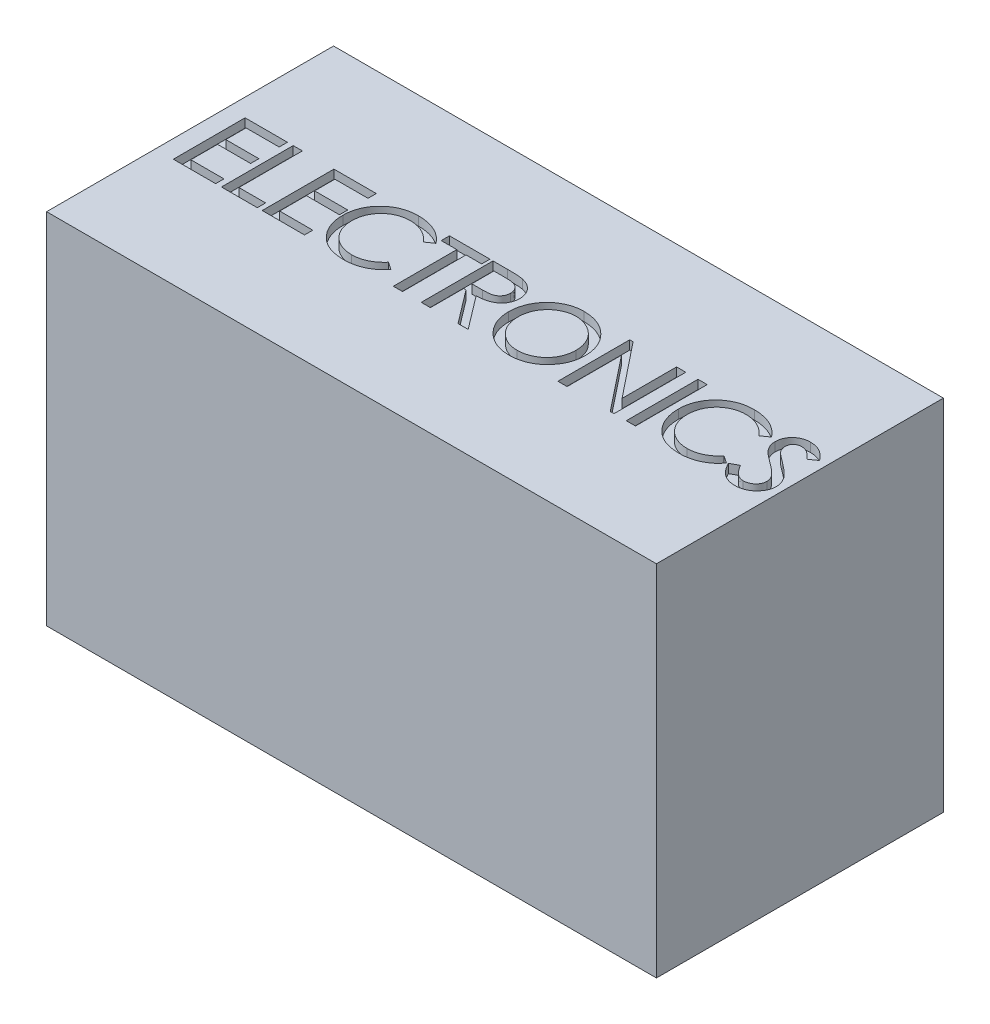
from build123d import *

# Parameters (mm, degrees)
SKETCH1_W           = 215.9
SKETCH1_H           = 127
BOSS_EXTRUDE1_DEPTH = 101.6
SKETCH2_W           = 3.256410256
SKETCH2_H           = 25.4
CUT_EXTRUDE1_DEPTH  = 3.175


with BuildPart() as part:
    # Sketch1 → Boss-Extrude1 (new body)
    with BuildSketch(Plane.XY):
        Rectangle(SKETCH1_W, SKETCH1_H)
    extrude(amount=BOSS_EXTRUDE1_DEPTH)

    # Sketch2 → Cut-Extrude1 (cut)
    # profile 1 of 11: a face of its own
    with BuildSketch(Plane(origin=(0, 63.5, 0), x_dir=(1, 0, 0), z_dir=(0, 1, 0))):
        Polygon((-101.60019791, -37.675335967), (-86.62071073, -37.675335967), (-86.62071073, -40.606105198), (-98.343787653, -40.606105198), (-98.343787653, -47.770207762), (-86.62071073, -47.770207762), (-86.62071073, -50.700976993), (-98.343787653, -50.700976993), (-98.343787653, -60.144566736), (-86.62071073, -60.144566736), (-86.62071073, -63.075335967), (-101.60019791, -63.075335967), align=None)
    # profile 2 of 11: a face of its own
    with BuildSketch(Plane(origin=(0, 63.5, 0), x_dir=(1, 0, 0), z_dir=(0, 1, 0))):
        Polygon((-84.569172269, -37.675335967), (-81.312762012, -37.675335967), (-81.312762012, -60.144566736), (-71.869172269, -60.144566736), (-71.869172269, -63.075335967), (-84.569172269, -63.075335967), align=None)
    # profile 3 of 11: a face of its own
    with BuildSketch(Plane(origin=(0, 63.5, 0), x_dir=(1, 0, 0), z_dir=(0, 1, 0))):
        Polygon((-70.143274833, -37.675335967), (-55.163787653, -37.675335967), (-55.163787653, -40.606105198), (-66.886864576, -40.606105198), (-66.886864576, -47.770207762), (-55.163787653, -47.770207762), (-55.163787653, -50.700976993), (-66.886864576, -50.700976993), (-66.886864576, -60.144566736), (-55.163787653, -60.144566736), (-55.163787653, -63.075335967), (-70.143274833, -63.075335967), align=None)
    # profile 4 of 11: a face of its own
    with BuildSketch(Plane(origin=(0, 63.5, 0), x_dir=(1, 0, 0), z_dir=(0, 1, 0))):
        with BuildLine():
            Line((-29.34045432, -42.397130839), (-31.935406243, -44.18815648))
            add(Edge.make_bspline(
                [(-31.935406243, -44.18815648), (-32.246206376, -43.847721104), (-32.85463474, -43.181278212), (-33.85656597, -42.308279144), (-34.905128984, -41.573513545), (-36.001800263, -40.979427652), (-37.147740912, -40.514352521), (-38.34897869, -40.191203049), (-39.606768585, -39.992053325), (-40.464080579, -39.967386164), (-40.90071073, -39.954823146)],
                knots=[0, 0, 0, 0, 1.078723025, 2.111729107, 3.104379151, 4.071093171, 5.02612831, 5.993405043, 6.978038489, 8, 8, 8, 8], degree=3))
            add(Edge.make_bspline(
                [(-40.90071073, -39.954823146), (-41.128175221, -39.958101761), (-41.580692997, -39.964624234), (-42.251271046, -40.036334265), (-42.911592125, -40.134485284), (-43.56103496, -40.283615634), (-44.198445813, -40.478575713), (-44.828167704, -40.704670129), (-45.44066424, -40.984710591), (-46.041877114, -41.295973807), (-46.622785649, -41.646075945), (-47.169949892, -42.034926739), (-47.693324751, -42.445150943), (-48.178113575, -42.896143983), (-48.628740447, -43.379990776), (-49.055076475, -43.890602525), (-49.44634602, -44.434620835), (-49.80104518, -45.010414785), (-50.124585055, -45.609405219), (-50.396104459, -46.235982181), (-50.631834696, -46.879516307), (-50.827459019, -47.543358574), (-50.9721441, -48.229519745), (-51.079426069, -48.936132082), (-51.148175826, -49.661630447), (-51.15497468, -50.153000621), (-51.158403038, -50.400776672)],
                knots=[0, 0, 0, 0, 1.002068956, 1.993515617, 2.969284448, 3.943018425, 4.926742606, 5.905741285, 6.889351865, 7.892340394, 8.888397413, 9.875523532, 10.849114049, 11.817064186, 12.790109362, 13.76151668, 14.746886598, 15.740472426, 16.740336546, 17.744438579, 18.747064952, 19.759451636, 20.791569268, 21.834966327, 22.908270136, 24, 24, 24, 24], degree=3))
            add(Edge.make_bspline(
                [(-51.158403038, -50.400776672), (-51.150554133, -50.772716514), (-51.135189662, -51.500800051), (-50.986683577, -52.566897518), (-50.754961651, -53.582851267), (-50.429230521, -54.54858107), (-50.008347317, -55.46298985), (-49.493432322, -56.32457534), (-48.881522567, -57.135438336), (-48.182762148, -57.885097834), (-47.421047283, -58.573091827), (-46.595485921, -59.161731843), (-45.734348044, -59.672888122), (-44.820613973, -60.078741478), (-43.867195504, -60.401522619), (-42.866713713, -60.630168358), (-41.822276417, -60.770457821), (-41.109767022, -60.787299317), (-40.748066499, -60.795848787)],
                knots=[0, 0, 0, 0, 1.083728652, 2.12143175, 3.131304262, 4.117911469, 5.086904967, 6.060353746, 7.03835, 8.042493243, 9.043967071, 10.025107856, 10.993520914, 11.958418665, 12.934074928, 13.923564625, 14.94591178, 16, 16, 16, 16], degree=3))
            add(Edge.make_bspline(
                [(-40.748066499, -60.795848787), (-40.32833754, -60.783510734), (-39.499345883, -60.759142287), (-38.280416811, -60.553885786), (-37.105948065, -60.222360285), (-35.974671572, -59.755012723), (-34.885663972, -59.156435184), (-33.844041225, -58.422025252), (-32.843998113, -57.55842381), (-32.236139511, -56.899529115), (-31.925229961, -56.562515454)],
                knots=[0, 0, 0, 0, 0.996377973, 1.967910503, 2.926842387, 3.889624876, 4.868586907, 5.872161968, 6.91164629, 8, 8, 8, 8], degree=3))
            Line((-31.925229961, -56.562515454), (-29.34045432, -58.343364813))
            add(Edge.make_bspline(
                [(-29.34045432, -58.343364813), (-29.507781616, -58.555564153), (-29.840239198, -58.977176651), (-30.377133326, -59.573531174), (-30.941073273, -60.134400245), (-31.5376124, -60.654581466), (-32.166112479, -61.133568876), (-32.823628702, -61.576908643), (-33.509529231, -61.98389562), (-34.22343934, -62.350174767), (-34.961291946, -62.677999318), (-35.724593507, -62.954065978), (-36.506028551, -63.197602003), (-37.312487331, -63.388263751), (-38.140821633, -63.542789731), (-38.992314354, -63.64650845), (-39.863242284, -63.716709365), (-40.451116388, -63.723292639), (-40.748066499, -63.726618018)],
                knots=[0, 0, 0, 0, 0.990136069, 1.967271632, 2.938597646, 3.903378639, 4.8655934, 5.832714132, 6.808088679, 7.786607084, 8.77175572, 9.76479442, 10.759640537, 11.769709565, 12.799869661, 13.846050076, 14.911985293, 16, 16, 16, 16], degree=3))
            add(Edge.make_bspline(
                [(-40.748066499, -63.726618018), (-41.021254893, -63.724766612), (-41.559758758, -63.721117155), (-42.355586498, -63.659799531), (-43.130325212, -63.576883885), (-43.881886615, -63.452490276), (-44.613817074, -63.30352714), (-45.320142328, -63.106019767), (-46.010445225, -62.885703571), (-46.674681812, -62.619261917), (-47.317860396, -62.322965717), (-47.942243606, -61.998230231), (-48.54168876, -61.631827616), (-49.116694835, -61.227316577), (-49.674030082, -60.794880377), (-50.208057685, -60.32489068), (-50.724334038, -59.823332417), (-51.0436502, -59.461503483), (-51.204196307, -59.279582762)],
                knots=[0, 0, 0, 0, 1.116169561, 2.200172621, 3.260333751, 4.299600589, 5.312386579, 6.311224183, 7.295427787, 8.272379731, 9.233840239, 10.188782295, 11.146938977, 12.102635432, 13.060741968, 14.028403985, 15.00871894, 16, 16, 16, 16], degree=3))
            add(Edge.make_bspline(
                [(-51.204196307, -59.279582762), (-51.461557679, -58.963721752), (-51.971690733, -58.337632685), (-52.621863433, -57.319958031), (-53.182654054, -56.260769408), (-53.628224415, -55.144976027), (-53.980412226, -53.985737006), (-54.237108185, -52.779515075), (-54.385013, -51.522184151), (-54.404768886, -50.667441485), (-54.414813294, -50.232868018)],
                knots=[0, 0, 0, 0, 0.995996121, 1.974230005, 2.94855815, 3.923972302, 4.908363682, 5.909282248, 6.937024559, 8, 8, 8, 8], degree=3))
            add(Edge.make_bspline(
                [(-54.414813294, -50.232868018), (-54.403473609, -49.776012313), (-54.381163486, -48.877177234), (-54.19327078, -47.557717752), (-53.887122775, -46.295526657), (-53.466330408, -45.085157311), (-52.908737406, -43.936512342), (-52.243776749, -42.834748911), (-51.439609645, -41.800395692), (-50.535808747, -40.82449554), (-49.541438547, -39.931372459), (-48.467593788, -39.156890298), (-47.337206223, -38.495056549), (-46.146112958, -37.952893613), (-44.891086587, -37.532890558), (-43.574201903, -37.24233046), (-42.198282489, -37.058346615), (-41.260865473, -37.035621758), (-40.783683487, -37.024053916)],
                knots=[0, 0, 0, 0, 1.034323922, 2.034967744, 3.011348252, 3.972313581, 4.931003742, 5.898099022, 6.881526582, 7.89265862, 8.907395938, 9.903191422, 10.886146247, 11.869423756, 12.861842533, 13.877618994, 14.91962492, 16, 16, 16, 16], degree=3))
            add(Edge.make_bspline(
                [(-40.783683487, -37.024053916), (-40.483361494, -37.027531351), (-39.888751999, -37.034416348), (-39.007175316, -37.10244333), (-38.147970501, -37.214103315), (-37.310965964, -37.367909594), (-36.493684317, -37.557968179), (-35.700450989, -37.805788434), (-34.926771249, -38.08889143), (-34.177852952, -38.415748228), (-33.455533852, -38.779360833), (-32.768002996, -39.189562433), (-32.110509686, -39.630609363), (-31.488294739, -40.111694461), (-30.89721098, -40.624885594), (-30.340145145, -41.17608958), (-29.819999644, -41.767541876), (-29.500837966, -42.186565187), (-29.34045432, -42.397130839)],
                knots=[0, 0, 0, 0, 1.097463626, 2.172875475, 3.229307817, 4.262776093, 5.282168658, 6.293918414, 7.298043722, 8.291879901, 9.278790577, 10.251524626, 11.216027204, 12.170719329, 13.124142787, 14.075306658, 15.032812027, 16, 16, 16, 16], degree=3))
        make_face()
    # profile 5 of 11: a face of its own
    with BuildSketch(Plane(origin=(0, 63.5, 0), x_dir=(1, 0, 0), z_dir=(0, 1, 0))):
        Polygon((-29.242762012, -40.606105198), (-29.242762012, -37.675335967), (-14.914556884, -37.675335967), (-14.914556884, -40.606105198), (-20.45045432, -40.606105198), (-20.45045432, -63.075335967), (-23.706864576, -63.075335967), (-23.706864576, -40.606105198), align=None)
    # profile 6 of 11: a face of its own
    with BuildSketch(Plane(origin=(0, 63.5, 0), x_dir=(1, 0, 0), z_dir=(0, 1, 0))):
        with BuildLine():
            Line((-13.839941499, -37.675335967), (-8.639861371, -37.675335967))
            add(Edge.make_bspline(
                [(-8.639861371, -37.675335967), (-8.305729452, -37.67614387), (-7.666260868, -37.677690052), (-6.748674121, -37.693915119), (-5.915529769, -37.715403782), (-5.166198133, -37.760290487), (-4.498672599, -37.799911326), (-3.915840316, -37.865076506), (-3.414957264, -37.923196792), (-3.113810872, -37.987140776), (-2.97676041, -38.016241416)],
                knots=[0, 0, 0, 0, 1.411347063, 2.701065231, 3.876524531, 4.931206492, 5.871916627, 6.700262025, 7.408494688, 8, 8, 8, 8], degree=3))
            add(Edge.make_bspline(
                [(-2.97676041, -38.016241416), (-2.772407729, -38.067613099), (-2.369801821, -38.168823141), (-1.789768062, -38.368084261), (-1.242164273, -38.602998828), (-0.727712203, -38.872274799), (-0.245174902, -39.177264708), (0.196112151, -39.527169395), (0.613533027, -39.9041154), (0.990981595, -40.31992899), (1.334402705, -40.762097647), (1.628036744, -41.230543442), (1.879977339, -41.718975135), (2.090250128, -42.226666664), (2.247474564, -42.759279527), (2.357601171, -43.312893775), (2.433391254, -43.8858652), (2.439185086, -44.276102563), (2.442109783, -44.473092377)],
                knots=[0, 0, 0, 0, 1.103820101, 2.174693741, 3.209859002, 4.223626675, 5.214778413, 6.196198804, 7.171320727, 8.158999421, 9.134971582, 10.10159085, 11.051641808, 12.012235658, 12.97676874, 13.956376421, 14.968389326, 16, 16, 16, 16], degree=3))
            add(Edge.make_bspline(
                [(2.442109783, -44.473092377), (2.431222213, -44.797972494), (2.40982446, -45.436471679), (2.215361304, -46.367674957), (1.896690871, -47.245470431), (1.53321421, -47.931183224), (1.179616774, -48.440968768), (0.883578169, -48.803387183), (0.558115876, -49.1429173), (0.20553762, -49.463093957), (-0.183435235, -49.74976832), (-0.596936507, -50.021580482), (-1.03984401, -50.271452518), (-1.678271445, -50.571485868), (-2.541781963, -50.884205234), (-3.65750354, -51.152300052), (-4.863125194, -51.315149063), (-5.696703392, -51.339637826), (-6.126319705, -51.352259044)],
                knots=[0, 0, 0, 0, 1.258986715, 2.474334223, 3.670931197, 4.871716255, 5.472099774, 6.075216246, 6.684756624, 7.295006596, 7.919971941, 8.55677058, 9.213641309, 9.890468445, 11.291088691, 12.766994829, 14.333747493, 16, 16, 16, 16], degree=3))
            Line((-6.126319705, -51.352259044), (2.767750808, -63.075335967))
            Line((2.767750808, -63.075335967), (-0.819388615, -63.075335967))
            Line((-0.819388615, -63.075335967), (-9.713459128, -51.352259044))
            Line((-9.713459128, -51.352259044), (-10.583531243, -51.352259044))
            Line((-10.583531243, -51.352259044), (-10.583531243, -63.075335967))
            Line((-10.583531243, -63.075335967), (-13.839941499, -63.075335967))
            Line((-13.839941499, -63.075335967), (-13.839941499, -37.675335967))
        make_face()
        with BuildLine():
            Line((-10.583531243, -40.606105198), (-10.583531243, -48.426577954))
            Line((-10.583531243, -48.426577954), (-6.84883573, -48.452018659))
            add(Edge.make_bspline(
                [(-6.84883573, -48.452018659), (-6.648683432, -48.451501507), (-6.261831867, -48.450501963), (-5.70187093, -48.429920023), (-5.182493642, -48.39545497), (-4.705751586, -48.34441018), (-4.273027551, -48.283512025), (-3.881004569, -48.21530558), (-3.53336366, -48.123205106), (-3.12727542, -47.990445616), (-2.676106273, -47.777154942), (-2.197499422, -47.452411028), (-1.777983623, -47.06808457), (-1.433958942, -46.617753949), (-1.158702412, -46.123691671), (-0.95845958, -45.596181849), (-0.837834802, -45.038197873), (-0.822234542, -44.656859385), (-0.814300474, -44.462916095)],
                knots=[0, 0, 0, 0, 1.165824803, 2.253289887, 3.263370799, 4.197285623, 5.045371766, 5.808848116, 6.513348392, 7.138183875, 8.296069948, 9.40583476, 10.496436725, 11.595152671, 12.691956992, 13.780050175, 14.870965332, 16, 16, 16, 16], degree=3))
            add(Edge.make_bspline(
                [(-0.814300474, -44.462916095), (-0.822609889, -44.275830236), (-0.839091301, -43.90475247), (-0.95631418, -43.360148529), (-1.165846515, -42.846367617), (-1.443848231, -42.364070165), (-1.7883058, -41.930489355), (-2.184439871, -41.548429861), (-2.642056883, -41.245594533), (-3.063362611, -41.041201044), (-3.440945032, -40.913013119), (-3.775278458, -40.833849648), (-4.155826299, -40.763950337), (-4.58336609, -40.702514734), (-5.057107682, -40.657629242), (-5.578232796, -40.629390429), (-6.146484269, -40.607202767), (-6.541826144, -40.606480284), (-6.74707291, -40.606105198)],
                knots=[0, 0, 0, 0, 1.114111647, 2.20979856, 3.297775031, 4.406653707, 5.514151176, 6.585969385, 7.670234779, 8.768154562, 9.365517569, 10.041721951, 10.812428959, 11.669578816, 12.61341719, 13.645562296, 14.777663698, 16, 16, 16, 16], degree=3))
            Line((-6.74707291, -40.606105198), (-10.583531243, -40.606105198))
        make_face(mode=Mode.SUBTRACT)
    # profile 7 of 11: a face of its own
    with BuildSketch(Plane(origin=(0, 63.5, 0), x_dir=(1, 0, 0), z_dir=(0, 1, 0))):
        with BuildLine():
            add(Edge.make_bspline(
                [(17.687197924, -37.024053916), (18.174567103, -37.035305544), (19.132500969, -37.057420845), (20.537783897, -37.245976721), (21.879784819, -37.547627006), (23.156524277, -37.978491217), (24.368864224, -38.530558744), (25.518717275, -39.204890576), (26.602668873, -40.00352952), (27.607466345, -40.916237762), (28.520200397, -41.910452754), (29.329078356, -42.96140284), (30.000760365, -44.073741165), (30.562252905, -45.231371535), (30.987113062, -46.445033372), (31.301888917, -47.704443819), (31.487535863, -49.018039995), (31.510302406, -49.911731241), (31.521853372, -50.365159685)],
                knots=[0, 0, 0, 0, 1.090651108, 2.14369656, 3.167927427, 4.165692988, 5.154576575, 6.145033357, 7.14440862, 8.163220312, 9.178978109, 10.162394332, 11.12677451, 12.082874982, 13.037579715, 13.999894772, 14.985214855, 16, 16, 16, 16], degree=3))
            add(Edge.make_bspline(
                [(31.521853372, -50.365159685), (31.510524499, -50.815253255), (31.488197428, -51.702302769), (31.29898344, -53.007894367), (30.993939444, -54.265778758), (30.566748214, -55.478405499), (30.006354096, -56.636525089), (29.331312758, -57.749854068), (28.527301334, -58.807758065), (27.617973215, -59.808932627), (26.618683064, -60.72491766), (25.545710379, -61.529357741), (24.412070348, -62.206439805), (23.223410402, -62.770079604), (21.9700068, -63.193243653), (20.661218318, -63.507037499), (19.291893163, -63.692435221), (18.35939312, -63.71510209), (17.885635424, -63.726618018)],
                knots=[0, 0, 0, 0, 1.015667565, 2.001689161, 2.971180881, 3.933912672, 4.898051938, 5.870540525, 6.8683264, 7.892867857, 8.919988739, 9.923897136, 10.914753654, 11.896185405, 12.887840524, 13.895451133, 14.930781579, 16, 16, 16, 16], degree=3))
            add(Edge.make_bspline(
                [(17.885635424, -63.726618018), (17.423651993, -63.715450285), (16.514606129, -63.693475509), (15.181021273, -63.503124746), (13.901558159, -63.206381146), (12.677869926, -62.779904271), (11.508012891, -62.23594075), (10.398652055, -61.561166759), (9.339985304, -60.775262419), (8.352149843, -59.874939683), (7.450615883, -58.889032913), (6.659833508, -57.839572669), (5.987268639, -56.739909347), (5.440148899, -55.588785168), (5.013925108, -54.385106865), (4.718250155, -53.12916376), (4.526837713, -51.824535592), (4.504820098, -50.93740817), (4.493648244, -50.487275069)],
                knots=[0, 0, 0, 0, 1.056734814, 2.079339537, 3.076314658, 4.058285941, 5.039336339, 6.023146808, 7.024524339, 8.052147497, 9.076900738, 10.077495695, 11.054668894, 12.021676166, 12.988994953, 13.970866516, 14.970407042, 16, 16, 16, 16], degree=3))
            add(Edge.make_bspline(
                [(4.493648244, -50.487275069), (4.497524598, -50.185139451), (4.505228405, -49.58467979), (4.5981121, -48.693039789), (4.732620048, -47.815642299), (4.926403377, -46.955440102), (5.176353025, -46.112280118), (5.484426804, -45.28793372), (5.83728262, -44.475433538), (6.258155085, -43.690907594), (6.715104719, -42.929799781), (7.222875128, -42.212551968), (7.759983806, -41.530430325), (8.349044952, -40.901643999), (8.970363255, -40.30775924), (9.634093125, -39.757940054), (10.336164504, -39.247218528), (11.079603735, -38.786968175), (11.846090578, -38.370704708), (12.636224926, -38.013494713), (13.439275468, -37.706909007), (14.259003486, -37.458418447), (15.093232174, -37.2622431), (15.943782268, -37.128658305), (16.809976162, -37.035590398), (17.393532591, -37.027915955), (17.687197924, -37.024053916)],
                knots=[0, 0, 0, 0, 1.036913812, 2.060746492, 3.074578145, 4.08324605, 5.085523353, 6.091481477, 7.103103322, 8.124200051, 9.145827961, 10.149052085, 11.139400635, 12.124186929, 13.104469564, 14.088618662, 15.081002312, 16.082788945, 17.088477375, 18.073521874, 19.057670972, 20.037642247, 21.012252997, 21.997331918, 22.992189685, 24, 24, 24, 24], degree=3))
        make_face()
        with BuildLine():
            add(Edge.make_bspline(
                [(17.794048885, -39.954823146), (17.580157711, -39.958208937), (17.154723396, -39.964943349), (16.520939823, -40.035435374), (15.893719184, -40.14132457), (15.271975074, -40.290246416), (14.655194882, -40.476327355), (14.048687348, -40.714377106), (13.446592363, -40.986747129), (12.859649692, -41.309607917), (12.287478533, -41.660072542), (11.746288569, -42.051319742), (11.229868616, -42.467199564), (10.745660626, -42.921723001), (10.294573669, -43.408939437), (9.874102777, -43.928047497), (9.48103867, -44.477251717), (9.123988826, -45.060358863), (8.794213138, -45.665300601), (8.516616395, -46.295993243), (8.281471381, -46.945726333), (8.088480314, -47.61381577), (7.933855386, -48.30158321), (7.830402705, -49.009283615), (7.759687182, -49.73618538), (7.753300844, -50.227605031), (7.750058501, -50.477098787)],
                knots=[0, 0, 0, 0, 0.951425037, 1.892405618, 2.834142553, 3.780555396, 4.735506122, 5.698386817, 6.677778342, 7.674036042, 8.677244726, 9.661625187, 10.643485342, 11.625954439, 12.613944774, 13.595804929, 14.596853729, 15.616869823, 16.636634596, 17.660413109, 18.67984269, 19.709280547, 20.753005387, 21.813969624, 22.890152378, 24, 24, 24, 24], degree=3))
            add(Edge.make_bspline(
                [(7.750058501, -50.477098787), (7.757934629, -50.840571694), (7.773382542, -51.55347241), (7.922362676, -52.599159461), (8.153333124, -53.598389186), (8.48026105, -54.550150275), (8.90121548, -55.45415473), (9.416431742, -56.310141404), (10.026773512, -57.120255234), (10.724959316, -57.868928754), (11.481862652, -58.553008432), (12.284711354, -59.149107705), (13.115124571, -59.664567768), (13.986429067, -60.077724814), (14.890084369, -60.399704599), (15.827624581, -60.628815572), (16.799222866, -60.770471918), (17.459444555, -60.787313415), (17.794048885, -60.795848787)],
                knots=[0, 0, 0, 0, 1.087324682, 2.132633634, 3.154656843, 4.153212625, 5.138884617, 6.133989092, 7.13811672, 8.169089965, 9.193543553, 10.187520856, 11.158295186, 12.114249704, 13.068004623, 14.02467326, 14.998892505, 16, 16, 16, 16], degree=3))
            add(Edge.make_bspline(
                [(17.794048885, -60.795848787), (18.031658745, -60.792454076), (18.502736026, -60.785723835), (19.201056045, -60.716215194), (19.885558864, -60.609042165), (20.556647794, -60.464769377), (21.212324883, -60.265788299), (21.857538064, -60.036873336), (22.485205091, -59.75139198), (23.099834985, -59.43556709), (23.68573686, -59.072352201), (24.249513649, -58.686229724), (24.77977238, -58.266096588), (25.266342749, -57.803553207), (25.729061247, -57.319552761), (26.155368348, -56.800515051), (26.548245285, -56.249828599), (26.903751435, -55.669256847), (27.22262735, -55.065754191), (27.506052814, -54.443796683), (27.73641857, -53.802466855), (27.934095923, -53.14803775), (28.079844864, -52.473830497), (28.185232549, -51.783924241), (28.255588587, -51.077252612), (28.2621315, -50.601080334), (28.265443116, -50.360071544)],
                knots=[0, 0, 0, 0, 1.036970321, 2.055862331, 3.060095599, 4.060719653, 5.049301004, 6.049377071, 7.046955997, 8.056986028, 9.063944937, 10.053856218, 11.039021426, 12.013303897, 12.982198174, 13.960523328, 14.942567566, 15.933032457, 16.929951754, 17.920776327, 18.913894254, 19.902475604, 20.903099658, 21.921964767, 22.948227815, 24, 24, 24, 24], degree=3))
            add(Edge.make_bspline(
                [(28.265443116, -50.360071544), (28.262116326, -50.120759211), (28.255543909, -49.647972978), (28.185585993, -48.948026053), (28.07996834, -48.266563093), (27.933194675, -47.601111935), (27.737419311, -46.95458808), (27.505868105, -46.322043304), (27.222613051, -45.710206961), (26.903556207, -45.116975169), (26.547358931, -44.544110068), (26.149924321, -44.002358106), (25.722173911, -43.485453638), (25.257772061, -43.001013252), (24.756412491, -42.547271613), (24.222856444, -42.120830241), (23.655497929, -41.720045745), (23.052934421, -41.359112632), (22.431256429, -41.02747581), (21.793771055, -40.744659712), (21.151503663, -40.49713977), (20.498532278, -40.298291883), (19.834980589, -40.146675423), (19.162496136, -40.033558341), (18.480669742, -39.965560696), (18.023165729, -39.958406133), (17.794048885, -39.954823146)],
                knots=[0, 0, 0, 0, 1.048789873, 2.071992723, 3.080474812, 4.070813472, 5.056451928, 6.039816187, 7.021295338, 8.009314668, 8.991328769, 9.975844821, 10.952581135, 11.930703152, 12.91499457, 13.914777939, 14.923479275, 15.957618598, 16.991998452, 18.010408503, 19.012925223, 20.00783076, 20.999814803, 21.994803685, 22.995802798, 24, 24, 24, 24], degree=3))
        make_face(mode=Mode.SUBTRACT)
    # profile 8 of 11: a face of its own
    with BuildSketch(Plane(origin=(0, 63.5, 0), x_dir=(1, 0, 0), z_dir=(0, 1, 0))):
        Polygon((34.550314911, -63.075335967), (34.550314911, -37.675335967), (35.756204334, -37.675335967), (51.158007218, -56.974654877), (51.158007218, -37.675335967), (54.414417475, -37.675335967), (54.414417475, -63.075335967), (53.081324526, -63.075335967), (37.806725167, -43.826898467), (37.806725167, -63.075335967), align=None)
    # profile 9 of 11: a face of its own
    with BuildSketch(Plane(origin=(0, 63.5, 0), x_dir=(1, 0, 0), z_dir=(0, 1, 0))):
        with Locations((60.373648244, -50.375335967)):
            Rectangle(SKETCH2_W, SKETCH2_H)
    # profile 10 of 11: a face of its own
    with BuildSketch(Plane(origin=(0, 63.5, 0), x_dir=(1, 0, 0), z_dir=(0, 1, 0))):
        with BuildLine():
            Line((89.453391834, -42.397130839), (86.858439911, -44.18815648))
            add(Edge.make_bspline(
                [(86.858439911, -44.18815648), (86.547639778, -43.847721104), (85.939211413, -43.181278212), (84.937280184, -42.308279144), (83.88871717, -41.573513545), (82.792045891, -40.979427652), (81.646105242, -40.514352521), (80.444867464, -40.191203049), (79.187077569, -39.992053325), (78.329765575, -39.967386164), (77.893135424, -39.954823146)],
                knots=[0, 0, 0, 0, 1.078723025, 2.111729107, 3.104379151, 4.071093171, 5.02612831, 5.993405043, 6.978038489, 8, 8, 8, 8], degree=3))
            add(Edge.make_bspline(
                [(77.893135424, -39.954823146), (77.665670932, -39.958101761), (77.213153157, -39.964624234), (76.542575108, -40.036334265), (75.882254029, -40.134485284), (75.232811194, -40.283615634), (74.595400341, -40.478575713), (73.96567845, -40.704670129), (73.353181914, -40.984710591), (72.75196904, -41.295973807), (72.171060505, -41.646075945), (71.623896262, -42.034926739), (71.100521403, -42.445150943), (70.615732579, -42.896143983), (70.165105706, -43.379990776), (69.738769678, -43.890602525), (69.347500134, -44.434620835), (68.992800974, -45.010414785), (68.669261099, -45.609405219), (68.397741695, -46.235982181), (68.162011458, -46.879516307), (67.966387135, -47.543358574), (67.821702054, -48.229519745), (67.714420085, -48.936132082), (67.645670328, -49.661630447), (67.638871474, -50.153000621), (67.635443116, -50.400776672)],
                knots=[0, 0, 0, 0, 1.002068956, 1.993515617, 2.969284448, 3.943018425, 4.926742606, 5.905741285, 6.889351865, 7.892340394, 8.888397413, 9.875523532, 10.849114049, 11.817064186, 12.790109362, 13.76151668, 14.746886598, 15.740472426, 16.740336546, 17.744438579, 18.747064952, 19.759451636, 20.791569268, 21.834966327, 22.908270136, 24, 24, 24, 24], degree=3))
            add(Edge.make_bspline(
                [(67.635443116, -50.400776672), (67.643292021, -50.772716514), (67.658656492, -51.500800051), (67.807162577, -52.566897518), (68.038884503, -53.582851267), (68.364615633, -54.54858107), (68.785498837, -55.46298985), (69.300413832, -56.32457534), (69.912323587, -57.135438336), (70.611084006, -57.885097834), (71.372798871, -58.573091827), (72.198360233, -59.161731843), (73.059498109, -59.672888122), (73.973232181, -60.078741478), (74.92665065, -60.401522619), (75.927132441, -60.630168358), (76.971569737, -60.770457821), (77.684079132, -60.787299317), (78.045779654, -60.795848787)],
                knots=[0, 0, 0, 0, 1.083728652, 2.12143175, 3.131304262, 4.117911469, 5.086904967, 6.060353746, 7.03835, 8.042493243, 9.043967071, 10.025107856, 10.993520914, 11.958418665, 12.934074928, 13.923564625, 14.94591178, 16, 16, 16, 16], degree=3))
            add(Edge.make_bspline(
                [(78.045779654, -60.795848787), (78.465508614, -60.783510734), (79.294500271, -60.759142287), (80.513429343, -60.553885786), (81.687898089, -60.222360285), (82.819174582, -59.755012723), (83.908182182, -59.156435184), (84.949804929, -58.422025252), (85.949848041, -57.55842381), (86.557706643, -56.899529115), (86.868616193, -56.562515454)],
                knots=[0, 0, 0, 0, 0.996377973, 1.967910503, 2.926842387, 3.889624876, 4.868586907, 5.872161968, 6.91164629, 8, 8, 8, 8], degree=3))
            Line((86.868616193, -56.562515454), (89.453391834, -58.343364813))
            add(Edge.make_bspline(
                [(89.453391834, -58.343364813), (89.286064538, -58.555564153), (88.953606956, -58.977176651), (88.416712828, -59.573531174), (87.852772881, -60.134400245), (87.256233754, -60.654581466), (86.627733675, -61.133568876), (85.970217452, -61.576908643), (85.284316923, -61.98389562), (84.570406814, -62.350174767), (83.832554208, -62.677999318), (83.069252647, -62.954065978), (82.287817603, -63.197602003), (81.481358822, -63.388263751), (80.653024521, -63.542789731), (79.8015318, -63.64650845), (78.93060387, -63.716709365), (78.342729766, -63.723292639), (78.045779654, -63.726618018)],
                knots=[0, 0, 0, 0, 0.990136069, 1.967271632, 2.938597646, 3.903378639, 4.8655934, 5.832714132, 6.808088679, 7.786607084, 8.77175572, 9.76479442, 10.759640537, 11.769709565, 12.799869661, 13.846050076, 14.911985293, 16, 16, 16, 16], degree=3))
            add(Edge.make_bspline(
                [(78.045779654, -63.726618018), (77.772591261, -63.724766612), (77.234087396, -63.721117155), (76.438259656, -63.659799531), (75.663520942, -63.576883885), (74.911959539, -63.452490276), (74.18002908, -63.30352714), (73.473703826, -63.106019767), (72.783400929, -62.885703571), (72.119164342, -62.619261917), (71.475985758, -62.322965717), (70.851602548, -61.998230231), (70.252157394, -61.631827616), (69.677151319, -61.227316577), (69.119816072, -60.794880377), (68.585788469, -60.32489068), (68.069512116, -59.823332417), (67.750195953, -59.461503483), (67.589649847, -59.279582762)],
                knots=[0, 0, 0, 0, 1.116169561, 2.200172621, 3.260333751, 4.299600589, 5.312386579, 6.311224183, 7.295427787, 8.272379731, 9.233840239, 10.188782295, 11.146938977, 12.102635432, 13.060741968, 14.028403985, 15.00871894, 16, 16, 16, 16], degree=3))
            add(Edge.make_bspline(
                [(67.589649847, -59.279582762), (67.332288475, -58.963721752), (66.822155421, -58.337632685), (66.171982721, -57.319958031), (65.611192099, -56.260769408), (65.165621738, -55.144976027), (64.813433928, -53.985737006), (64.556737969, -52.779515075), (64.408833154, -51.522184151), (64.389077267, -50.667441485), (64.379032859, -50.232868018)],
                knots=[0, 0, 0, 0, 0.995996121, 1.974230005, 2.94855815, 3.923972302, 4.908363682, 5.909282248, 6.937024559, 8, 8, 8, 8], degree=3))
            add(Edge.make_bspline(
                [(64.379032859, -50.232868018), (64.390372545, -49.776012313), (64.412682667, -48.877177234), (64.600575374, -47.557717752), (64.906723379, -46.295526657), (65.327515746, -45.085157311), (65.885108748, -43.936512342), (66.550069405, -42.834748911), (67.354236509, -41.800395692), (68.258037406, -40.82449554), (69.252407607, -39.931372459), (70.326252366, -39.156890298), (71.456639931, -38.495056549), (72.647733195, -37.952893613), (73.902759567, -37.532890558), (75.219644251, -37.24233046), (76.595563665, -37.058346615), (77.532980681, -37.035621758), (78.010162667, -37.024053916)],
                knots=[0, 0, 0, 0, 1.034323922, 2.034967744, 3.011348252, 3.972313581, 4.931003742, 5.898099022, 6.881526582, 7.89265862, 8.907395938, 9.903191422, 10.886146247, 11.869423756, 12.861842533, 13.877618994, 14.91962492, 16, 16, 16, 16], degree=3))
            add(Edge.make_bspline(
                [(78.010162667, -37.024053916), (78.31048466, -37.027531351), (78.905094154, -37.034416348), (79.786670837, -37.10244333), (80.645875653, -37.214103315), (81.482880189, -37.367909594), (82.300161837, -37.557968179), (83.093395165, -37.805788434), (83.867074905, -38.08889143), (84.615993202, -38.415748228), (85.338312302, -38.779360833), (86.025843158, -39.189562433), (86.683336468, -39.630609363), (87.305551415, -40.111694461), (87.896635173, -40.624885594), (88.453701009, -41.17608958), (88.97384651, -41.767541876), (89.293008188, -42.186565187), (89.453391834, -42.397130839)],
                knots=[0, 0, 0, 0, 1.097463626, 2.172875475, 3.229307817, 4.262776093, 5.282168658, 6.293918414, 7.298043722, 8.291879901, 9.278790577, 10.251524626, 11.216027204, 12.170719329, 13.124142787, 14.075306658, 15.032812027, 16, 16, 16, 16], degree=3))
        make_face()
    # profile 11 of 11: a face of its own
    with BuildSketch(Plane(origin=(0, 63.5, 0), x_dir=(1, 0, 0), z_dir=(0, 1, 0))):
        with BuildLine():
            Line((89.876725167, -58.038076352), (92.644673885, -56.562515454))
            add(Edge.make_bspline(
                [(92.644673885, -56.562515454), (92.846389882, -56.896642443), (93.231925033, -57.535251681), (93.864993318, -58.395534143), (94.494434662, -59.12912899), (95.126462393, -59.735295515), (95.769855861, -60.204296895), (96.418046736, -60.543253987), (97.075091911, -60.756299789), (97.519341367, -60.782807522), (97.737903052, -60.795848787)],
                knots=[0, 0, 0, 0, 1.354943589, 2.589672558, 3.704607527, 4.708856974, 5.624398268, 6.459549776, 7.242129862, 8, 8, 8, 8], degree=3))
            add(Edge.make_bspline(
                [(97.737903052, -60.795848787), (97.941942146, -60.789290121), (98.346084893, -60.776299289), (98.939893884, -60.663636775), (99.514858216, -60.491978828), (100.061014819, -60.247541716), (100.565588497, -59.948076272), (101.011016142, -59.591874976), (101.388949079, -59.188602616), (101.700453435, -58.743729857), (101.944629134, -58.268741215), (102.124379927, -57.777114869), (102.229875708, -57.267434263), (102.243963124, -56.92425141), (102.251084142, -56.750776672)],
                knots=[0, 0, 0, 0, 1.0888553, 2.156709112, 3.216967111, 4.287545289, 5.343926646, 6.34269433, 7.323221176, 8.28571565, 9.233736345, 10.167849744, 11.073870434, 12, 12, 12, 12], degree=3))
            add(Edge.make_bspline(
                [(102.251084142, -56.750776672), (102.241106931, -56.553070227), (102.220945269, -56.153550719), (102.059122886, -55.560059721), (101.79613198, -54.972375753), (101.552859464, -54.605447571), (101.426805295, -54.415319941)],
                knots=[0, 0, 0, 0, 0.941861274, 1.903286225, 2.913566088, 4, 4, 4, 4], degree=3))
            add(Edge.make_bspline(
                [(101.426805295, -54.415319941), (101.317805774, -54.276920831), (101.088352526, -53.985578949), (100.699953258, -53.546959214), (100.245475138, -53.089413757), (99.725655402, -52.615006727), (99.149630913, -52.113108084), (98.507616957, -51.596689653), (97.804152116, -51.057023876), (97.311183482, -50.694973868), (97.056092154, -50.507627634)],
                knots=[0, 0, 0, 0, 0.718593868, 1.512701116, 2.388487339, 3.348232282, 4.383172848, 5.504845107, 6.708858268, 8, 8, 8, 8], degree=3))
            add(Edge.make_bspline(
                [(97.056092154, -50.507627634), (96.795965769, -50.318524161), (96.296856077, -49.955687552), (95.593654103, -49.423767399), (94.963165093, -48.933307544), (94.410223881, -48.483924642), (93.934767625, -48.071712855), (93.537797908, -47.698363671), (93.207364298, -47.374122773), (93.029798695, -47.15595828), (92.949962347, -47.057868018)],
                knots=[0, 0, 0, 0, 1.435833971, 2.754963323, 3.936484598, 5.002077172, 5.935979083, 6.744956812, 7.435712417, 8, 8, 8, 8], degree=3))
            add(Edge.make_bspline(
                [(92.949962347, -47.057868018), (92.833412068, -46.907273715), (92.604439669, -46.61141909), (92.314552685, -46.136849114), (92.065111428, -45.656068122), (91.859659563, -45.164624383), (91.700446743, -44.664087892), (91.59091585, -44.152703301), (91.513654661, -43.632501938), (91.507848892, -43.281056355), (91.504930295, -43.104382441)],
                knots=[0, 0, 0, 0, 1.064105702, 2.090521257, 3.104283852, 4.09061442, 5.065433238, 6.036507983, 7.012940167, 8, 8, 8, 8], degree=3))
            add(Edge.make_bspline(
                [(91.504930295, -43.104382441), (91.514121309, -42.82886242), (91.532318845, -42.283352936), (91.694938895, -41.486990808), (91.958467482, -40.728199928), (92.318181204, -40.010902054), (92.77752907, -39.348449027), (93.323904692, -38.753923542), (93.960264337, -38.24001164), (94.669628845, -37.806986468), (95.434240151, -37.455800174), (96.239555045, -37.205490666), (97.075810876, -37.053744178), (97.643992187, -37.034024008), (97.931252411, -37.024053916)],
                knots=[0, 0, 0, 0, 1.004530234, 1.988896367, 2.951881425, 3.928924249, 4.907494835, 5.884204368, 6.865296418, 7.88218147, 8.909671266, 9.927572845, 10.952225504, 12, 12, 12, 12], degree=3))
            add(Edge.make_bspline(
                [(97.931252411, -37.024053916), (98.25742, -37.035728626), (98.903396491, -37.058850446), (99.855626566, -37.215543291), (100.766192464, -37.497657998), (101.499552802, -37.809060242), (102.069239637, -38.127444519), (102.500105445, -38.415000031), (102.941720675, -38.740430999), (103.380098065, -39.119959916), (103.832323186, -39.535223748), (104.275238479, -40.008795279), (104.736873707, -40.513533534), (105.031103109, -40.877537959), (105.181853372, -41.06403789)],
                knots=[0, 0, 0, 0, 1.360590218, 2.69465552, 4.010645498, 5.328858611, 6.009843139, 6.729980544, 7.488405022, 8.296451933, 9.147430815, 10.048128915, 10.999946711, 12, 12, 12, 12], degree=3))
            Line((105.181853372, -41.06403789), (102.525843757, -42.885592377))
            add(Edge.make_bspline(
                [(102.525843757, -42.885592377), (102.387233808, -42.737594466), (102.120721665, -42.453031629), (101.728687836, -42.04947804), (101.35777038, -41.687317538), (101.006843619, -41.368206888), (100.683773075, -41.08645516), (100.379480766, -40.851563078), (100.103482295, -40.649684004), (99.758459724, -40.449599564), (99.335488084, -40.251438917), (98.814909243, -40.073139787), (98.26884446, -39.977849863), (97.899354772, -39.962557973), (97.712462347, -39.954823146)],
                knots=[0, 0, 0, 0, 1.253377364, 2.409930098, 3.477532466, 4.457083962, 5.341772995, 6.126101147, 6.832963523, 7.453284126, 8.588253012, 9.715448048, 10.844445545, 12, 12, 12, 12], degree=3))
            add(Edge.make_bspline(
                [(97.712462347, -39.954823146), (97.512974635, -39.964145623), (97.125154237, -39.982269278), (96.568070573, -40.137467891), (96.055976012, -40.382366009), (95.604165036, -40.728962425), (95.228633889, -41.157955987), (94.95322685, -41.660467602), (94.792051063, -42.233146387), (94.771866288, -42.635218873), (94.761340552, -42.844887249)],
                knots=[0, 0, 0, 0, 1.033513523, 2.009234674, 2.977584268, 3.963375862, 4.942860848, 5.915719707, 6.913112236, 8, 8, 8, 8], degree=3))
            add(Edge.make_bspline(
                [(94.761340552, -42.844887249), (94.765441707, -42.980745604), (94.773634098, -43.252133705), (94.83380952, -43.654136647), (94.945043762, -44.042566859), (95.086000026, -44.425611515), (95.283290497, -44.801118375), (95.53455169, -45.16968039), (95.832821918, -45.541915815), (96.061733351, -45.775920936), (96.180931898, -45.897771864)],
                knots=[0, 0, 0, 0, 0.940834015, 1.879392378, 2.805520916, 3.734846727, 4.701501436, 5.734192883, 6.820151034, 8, 8, 8, 8], degree=3))
            add(Edge.make_bspline(
                [(96.180931898, -45.897771864), (96.241287199, -45.954551157), (96.379815271, -46.084871539), (96.633890632, -46.284430699), (96.943441854, -46.534624577), (97.312760419, -46.831369576), (97.753990355, -47.158554954), (98.250817833, -47.538039394), (98.815822565, -47.952738935), (99.213417976, -48.243471452), (99.422077731, -48.396049108)],
                knots=[0, 0, 0, 0, 0.485581606, 1.114511607, 1.892484918, 2.819534315, 3.891398566, 5.11240712, 6.484579029, 8, 8, 8, 8], degree=3))
            add(Edge.make_bspline(
                [(99.422077731, -48.396049108), (99.70635312, -48.603256768), (100.256293759, -49.004107201), (101.037503316, -49.608737329), (101.742044003, -50.201423575), (102.387728298, -50.7614885), (102.952720252, -51.312425719), (103.44760591, -51.84290731), (103.878600101, -52.347755362), (104.338907065, -52.991422508), (104.799121757, -53.78495351), (105.210648808, -54.744084828), (105.456219903, -55.710782561), (105.490550101, -56.355997113), (105.507494398, -56.674454557)],
                knots=[0, 0, 0, 0, 1.186540699, 2.295404303, 3.331123753, 4.291760032, 5.17774712, 5.991329992, 6.738459906, 7.414799035, 8.65800623, 9.82461674, 10.926299804, 12, 12, 12, 12], degree=3))
            add(Edge.make_bspline(
                [(105.507494398, -56.674454557), (105.500284662, -56.90039547), (105.485954759, -57.34947031), (105.382059014, -58.013456212), (105.209185632, -58.65882773), (104.960475953, -59.282859684), (104.650261773, -59.89140877), (104.26561694, -60.479154673), (103.807795194, -61.043832576), (103.296111277, -61.588854623), (102.730318056, -62.089751134), (102.123569059, -62.530606125), (101.477716737, -62.898893933), (100.797737965, -63.197695558), (100.087622535, -63.441181772), (99.34035287, -63.607949464), (98.559624872, -63.704210237), (98.028193509, -63.719070051), (97.758255616, -63.726618018)],
                knots=[0, 0, 0, 0, 0.932646097, 1.853705421, 2.767602683, 3.685675702, 4.622099834, 5.5835355, 6.579838097, 7.620108014, 8.666886363, 9.695041649, 10.711275682, 11.730160242, 12.757671447, 13.80585424, 14.885494678, 16, 16, 16, 16], degree=3))
            add(Edge.make_bspline(
                [(97.758255616, -63.726618018), (97.561413837, -63.722245911), (97.173716928, -63.713634668), (96.598150779, -63.659012016), (96.038053216, -63.554027826), (95.49035342, -63.418293842), (94.95470956, -63.245454942), (94.438024601, -63.024362302), (93.931694543, -62.770406848), (93.438623938, -62.473051319), (92.958184025, -62.124871408), (92.487644531, -61.720703012), (92.029738701, -61.253441353), (91.576617058, -60.729157142), (91.134265937, -60.141953269), (90.703718058, -59.494917439), (90.279476091, -58.790136159), (90.01362158, -58.293704046), (89.876725167, -58.038076352)],
                knots=[0, 0, 0, 0, 0.916943493, 1.805999526, 2.689245248, 3.568702553, 4.433092864, 5.307568578, 6.183755457, 7.069823058, 7.986358083, 8.944343836, 9.955449961, 11.030835633, 12.170024038, 13.377301724, 14.649494474, 16, 16, 16, 16], degree=3))
        make_face()
    extrude(amount=-CUT_EXTRUDE1_DEPTH, mode=Mode.SUBTRACT)


solid = part.part
